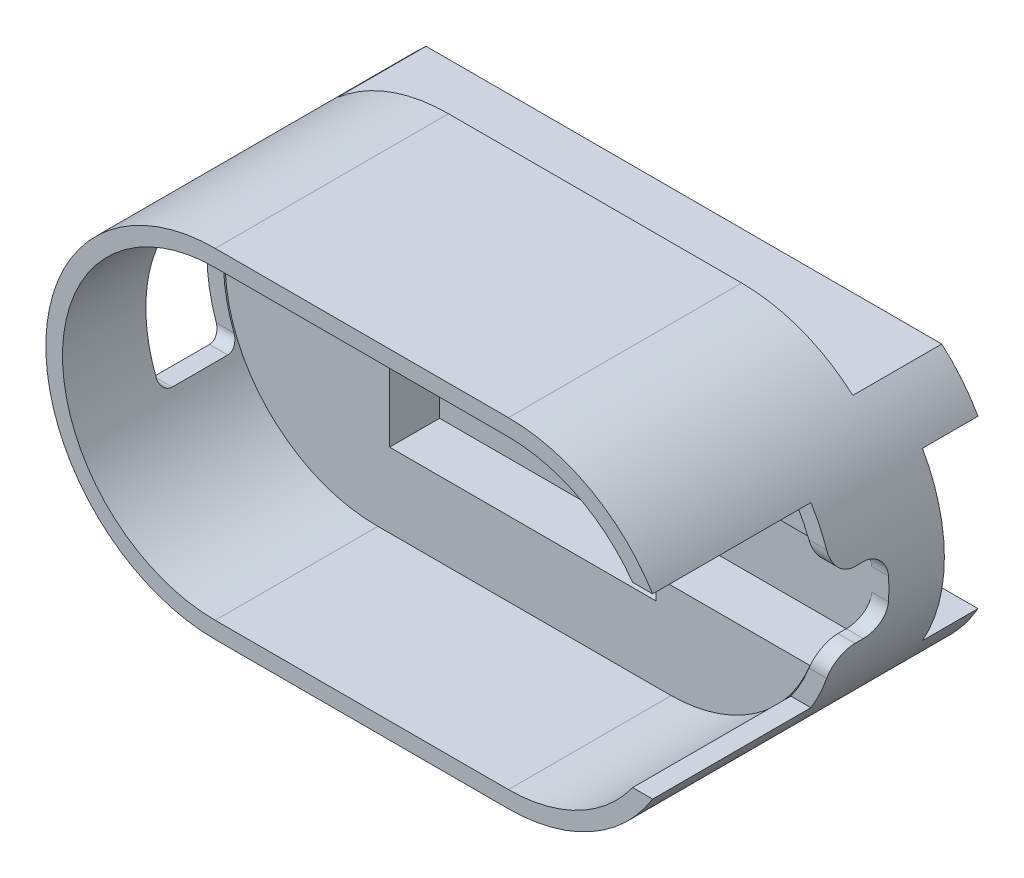
from build123d import *

# Parameters (mm, degrees)
BOSS_EXTRUDE1_DEPTH = 19
BOSS_EXTRUDE2_DEPTH = 2
BOSS_EXTRUDE3_DEPTH = 4.5
SKETCH4_W           = 4.75
SKETCH4_H           = 6
SKETCH4_W_2         = 14.25
SKETCH4_H_2         = 16
CUT_EXTRUDE1_DEPTH  = 49.452157546
SKETCH5_W           = 7
SKETCH5_H           = 12
CUT_EXTRUDE2_DEPTH  = 49.452157546
FILLET1_R           = 1
SKETCH6_R           = 1.25
BOSS_EXTRUDE4_DEPTH = 3
BOSS_EXTRUDE7_DEPTH = 8
FILLET2_R           = 2
SKETCH9_R           = 1.252428217
CUT_EXTRUDE3_DEPTH  = 10
CUT_EXTRUDE6_START  = -1.5
CUT_EXTRUDE6_DEPTH  = 2.1


with BuildPart() as part:
    # Sketch1 → Boss-Extrude1 (new body)
    with BuildSketch(Plane.XY):
        with BuildLine():
            Line((-34.384444189, 18.719216619), (-7.984444189, 18.719216619))
            ThreePointArc((-7.984444189, 18.719216619), (7.265555811, 3.469216619), (-7.984444189, -11.780783381))
            Line((-7.984444189, -11.780783381), (-34.384444189, -11.780783381))
            ThreePointArc((-34.384444189, -11.780783381), (-49.634444189, 3.469216619), (-34.384444189, 18.719216619))
        make_face()
        with BuildLine():
            Line((-34.384444189, 17.219216619), (-7.984444189, 17.219216619))
            ThreePointArc((-7.984444189, 17.219216619), (5.765555811, 3.469216619), (-7.984444189, -10.280783381))
            Line((-7.984444189, -10.280783381), (-34.384444189, -10.280783381))
            ThreePointArc((-34.384444189, -10.280783381), (-48.134444189, 3.469216619), (-34.384444189, 17.219216619))
        make_face(mode=Mode.SUBTRACT)
    extrude(amount=BOSS_EXTRUDE1_DEPTH)



with BuildPart() as body_2:
    # Sketch2 → Boss-Extrude2 (new body)
    with BuildSketch(Plane(origin=(0, 0, 0), x_dir=(-1, 0, 0), z_dir=(0, 0, -1))):
        with BuildLine():
            Line((34.384444189, -11.780783381), (7.984444189, -11.780783381))
            ThreePointArc((7.984444189, -11.780783381), (-7.265555811, 3.469216619), (7.984444189, 18.719216619))
            Line((7.984444189, 18.719216619), (34.384444189, 18.719216619))
            ThreePointArc((34.384444189, 18.719216619), (49.634444189, 3.469216619), (34.384444189, -11.780783381))
        make_face()
    extrude(amount=BOSS_EXTRUDE2_DEPTH)


with BuildPart() as part_1:
    add(part.part)

    add(body_2.part)  # Boss-Extrude3 merges body 2
    # Sketch3 → Boss-Extrude3 (add)
    with BuildSketch(Plane.XY):
        with BuildLine():
            Line((-22.664695889, -3.430783381), (-33.184444189, -3.430783381))
            Line((-33.184444189, -3.430783381), (-33.184444189, 10.369216619))
            Line((-33.184444189, 10.369216619), (-19.704192488, 10.369216619))
            Line((-19.704192488, 10.369216619), (-9.184444189, 10.369216619))
            Line((-9.184444189, 10.369216619), (-9.184444189, 8.469216619))
            Line((-9.184444189, 8.469216619), (4.663184056, 8.469216619))
            ThreePointArc((4.663184056, 8.469216619), (-0.337155761, 14.715615149), (-7.984444189, 17.069308538))
            Line((-7.984444189, 17.069308538), (-34.384444189, 17.069308538))
            ThreePointArc((-34.384444189, 17.069308538), (-47.984536108, 3.469216619), (-34.384444189, -10.1308753))
            Line((-34.384444189, -10.1308753), (-7.984444189, -10.1308753))
            ThreePointArc((-7.984444189, -10.1308753), (-0.337155761, -7.777181911), (4.663184056, -1.530783381))
            Line((4.663184056, -1.530783381), (-9.184444189, -1.530783381))
            Line((-9.184444189, -1.530783381), (-9.184444189, -3.430783381))
            Line((-9.184444189, -3.430783381), (-19.704192488, -3.430783381))
            Line((-19.704192488, -3.430783381), (-22.664695889, -3.430783381))
        make_face()
    extrude(amount=BOSS_EXTRUDE3_DEPTH)

    # Sketch4 → Cut-Extrude1 (cut, through all)
    with BuildSketch(Plane.ZY.offset(9.184444189)):
        with Locations((2.375, 3.469216619)):
            Rectangle(SKETCH4_W, SKETCH4_H)
        with Locations((11.875, 3.469216619)):
            Rectangle(SKETCH4_W_2, SKETCH4_H_2)
    extrude(amount=-CUT_EXTRUDE1_DEPTH, mode=Mode.SUBTRACT)

    # Sketch5 → Cut-Extrude2 (cut, through all)
    with BuildSketch(Plane(origin=(-33.184444189, 0, 0), x_dir=(0, 0, -1), z_dir=(1, 0, 0))):
        with Locations((-8, 3.469216619)):
            Rectangle(SKETCH5_W, SKETCH5_H)
    extrude(amount=-CUT_EXTRUDE2_DEPTH, mode=Mode.SUBTRACT)

    # Fillet1
    fillet1_edges = [part_1.edges().sort_by_distance(p)[0] for p in [
        (-47.580403151, -2.530783381, 11.5),
        (-47.580403151, 9.469216619, 11.5),
        (-47.580403151, 9.469216619, 4.5),
        (-47.580403151, -2.530783381, 4.5),
    ]]
    fillet(fillet1_edges, radius=FILLET1_R)

    # Sketch6 → Boss-Extrude4 (add)
    with BuildSketch(Plane(origin=(0, 0, -2), x_dir=(-1, 0, 0), z_dir=(0, 0, -1))):
        with BuildLine():
            ThreePointArc((47.662715914, -4.030783381), (49.634444189, 3.469216619), (47.662715914, 10.969216619))
            Line((47.662715914, 10.969216619), (-5.293827536, 10.969216619))
            ThreePointArc((-5.293827536, 10.969216619), (-7.265555811, 3.469216619), (-5.293827536, -4.030783381))
            Line((-5.293827536, -4.030783381), (47.662715914, -4.030783381))
        make_face()
        with Locations((21.184444189, 3.469216619)):
            Circle(SKETCH6_R, mode=Mode.SUBTRACT)
    extrude(amount=BOSS_EXTRUDE4_DEPTH)

    # Sketch10 → Boss-Extrude7 (add)
    with BuildSketch(Plane(origin=(0, 0, -2), x_dir=(-1, 0, 0), z_dir=(0, 0, -1))):
        with BuildLine():
            Line((-5.293827536, -4.030783381), (47.662715914, -4.030783381))
            ThreePointArc((47.662715914, -4.030783381), (46.201857789, -6.169830834), (44.400057001, -8.030783381))
            Line((44.400057001, -8.030783381), (-2.031168623, -8.030783381))
            ThreePointArc((-2.031168623, -8.030783381), (-3.832969412, -6.169830834), (-5.293827536, -4.030783381))
        make_face()
        with BuildLine():
            Line((-5.293827536, 10.969216619), (47.662715914, 10.969216619))
            ThreePointArc((47.662715914, 10.969216619), (46.201857789, 13.108264072), (44.400057001, 14.969216619))
            Line((44.400057001, 14.969216619), (-2.031168623, 14.969216619))
            ThreePointArc((-2.031168623, 14.969216619), (-3.832969412, 13.108264072), (-5.293827536, 10.969216619))
        make_face()
    extrude(amount=BOSS_EXTRUDE7_DEPTH)

    # Fillet2
    fillet2_edges = [part_1.edges().sort_by_distance(p)[0] for p in [
        (6.200927538, 0.469216619, 0),
        (6.200927538, 6.469216619, 0),
        (6.200927538, 6.469216619, 4.75),
        (6.200927538, 0.469216619, 4.75),
    ]]
    fillet(fillet2_edges, radius=FILLET2_R)

    # Sketch9 → Cut-Extrude3 (cut)
    with BuildSketch(Plane(origin=(0, 0, -2), x_dir=(-1, 0, 0), z_dir=(0, 0, -1))):
        with Locations((21.184444189, 3.469216619)):
            Circle(SKETCH9_R)
    extrude(amount=-CUT_EXTRUDE3_DEPTH, mode=Mode.SUBTRACT)

    # Sketch13 → Cut-Extrude6 (cut)
    with BuildSketch(Plane(origin=(0, 0, -5), x_dir=(-1, 0, 0), z_dir=(0, 0, -1)).offset(CUT_EXTRUDE6_START)):
        Polygon((17.951282681, 3.469216619), (19.567863435, 0.669216619), (22.801024943, 0.669216619), (24.417605696, 3.469216619), (22.801024943, 6.269216619), (19.567863435, 6.269216619), align=None)
    extrude(amount=-CUT_EXTRUDE6_DEPTH, mode=Mode.SUBTRACT)


solid = part_1.part
